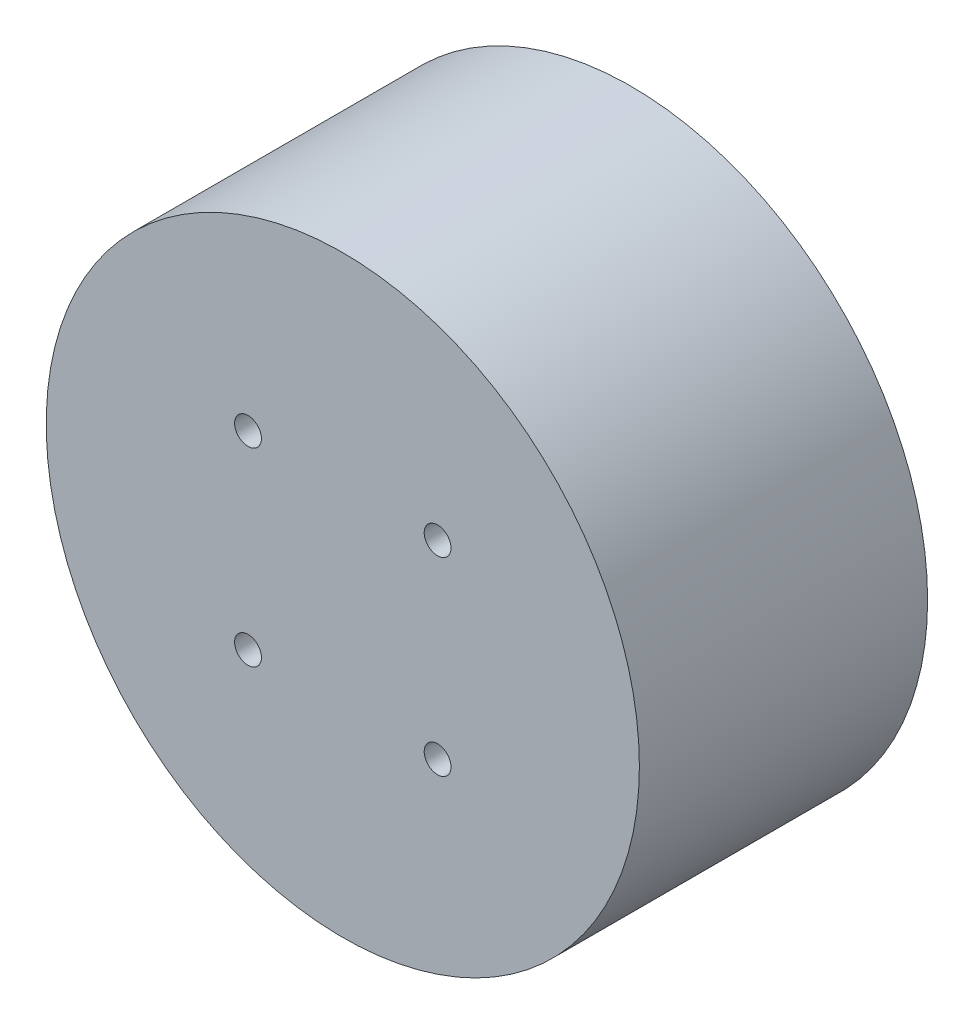
from build123d import *

# Parameters (mm, degrees)
SKETCH_1_R          = 44.25
EXTRUDE_1_DEPTH     = 43
SKETCH_2_R          = 2
CUT_EXTRUDE_1_DEPTH = 8
SKETCH_3_R          = 1.5
CUT_EXTRUDE_2_DEPTH = 20


with BuildPart() as part:
    # 草图1 → 凸台-拉伸1 (new body)
    with BuildSketch(Plane.XY):
        Circle(SKETCH_1_R)
    extrude(amount=EXTRUDE_1_DEPTH)

    # 草图2 → 切除-拉伸1 (cut)
    with BuildSketch(Plane.XY.offset(43)):
        with Locations((-14.142135624, 14.142135624)):
            Circle(SKETCH_2_R)
        with Locations((14.142135624, 14.142135624)):
            Circle(SKETCH_2_R)
        with Locations((-14.142135624, -14.142135624)):
            Circle(SKETCH_2_R)
        with Locations((14.142135624, -14.142135624)):
            Circle(SKETCH_2_R)
    extrude(amount=-CUT_EXTRUDE_1_DEPTH, mode=Mode.SUBTRACT)

    # 草图3 → 切除-拉伸2 (cut)
    with BuildSketch(Plane(origin=(0, 0, 0), x_dir=(-1, 0, 0), z_dir=(0, 0, -1))):
        with Locations((0, 15.5)):
            Circle(SKETCH_3_R)
        with Locations((15.5, 0)):
            Circle(SKETCH_3_R)
        with Locations((-15.5, 0)):
            Circle(SKETCH_3_R)
        with Locations((0, -15.5)):
            Circle(SKETCH_3_R)
    extrude(amount=-CUT_EXTRUDE_2_DEPTH, mode=Mode.SUBTRACT)


solid = part.part
